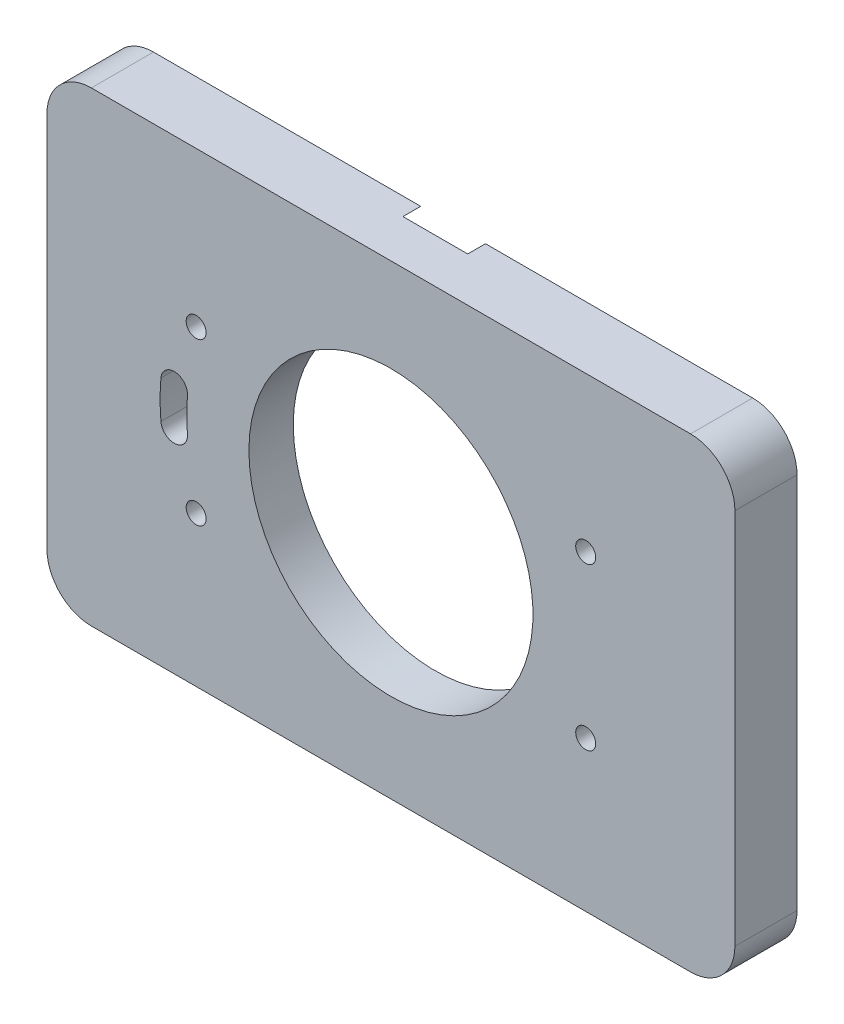
from build123d import *

# Parameters (mm, degrees)
SKETCH2_W           = 155
SKETCH2_H           = 105
BOSS_EXTRUDE1_DEPTH = 14
SKETCH3_R           = 53.5
CUT_EXTRUDE1_DEPTH  = 4
SKETCH4_R           = 32
CUT_EXTRUDE2_DEPTH  = 10
FILLET1_R           = 10
SKETCH5_R           = 2.25
CUT_EXTRUDE3_DEPTH  = 95.649352877
CUT_EXTRUDE4_DEPTH  = 95.649352877
SKETCH8_R           = 5
CUT_EXTRUDE6_DEPTH  = 2.5


with BuildPart() as part:
    # Sketch2 → Boss-Extrude1 (new body)
    with BuildSketch(Plane.XY):
        Rectangle(SKETCH2_W, SKETCH2_H)
    extrude(amount=BOSS_EXTRUDE1_DEPTH)

    # Sketch3 → Cut-Extrude1 (cut)
    with BuildSketch(Plane(origin=(0, 0, 0), x_dir=(-1, 0, 0), z_dir=(0, 0, -1))):
        with Locations((0, -0.5)):
            Circle(SKETCH3_R)
    extrude(amount=-CUT_EXTRUDE1_DEPTH, mode=Mode.SUBTRACT)

    # Sketch4 → Cut-Extrude2 (cut)
    with BuildSketch(Plane(origin=(0, 0, 4), x_dir=(-1, 0, 0), z_dir=(0, 0, -1))):
        with Locations((0, -0.5)):
            Circle(SKETCH4_R)
    extrude(amount=-CUT_EXTRUDE2_DEPTH, mode=Mode.SUBTRACT)

    # Fillet1
    fillet1_edges = [part.edges().sort_by_distance(p)[0] for p in [
        (77.5, -52.5, 7),
        (-77.5, -52.5, 7),
        (-77.5, 52.5, 7),
        (77.5, 52.5, 7),
    ]]
    fillet(fillet1_edges, radius=FILLET1_R)

    # Sketch5 → Cut-Extrude3 (cut, through all)
    with BuildSketch(Plane.XY.offset(14)):
        with Locations((43.884277794, 17.677463037)):
            Circle(SKETCH5_R)
        with Locations((43.884277794, -18.677463037)):
            Circle(SKETCH5_R)
        with Locations((-43.884277794, -18.677463037)):
            Circle(SKETCH5_R)
        with Locations((-43.884277794, 17.677463037)):
            Circle(SKETCH5_R)
    extrude(amount=-CUT_EXTRUDE3_DEPTH, mode=Mode.SUBTRACT)

    # Sketch6 → Cut-Extrude4 (cut, through all)
    with BuildSketch(Plane(origin=(0, 0, 0), x_dir=(-1, 0, 0), z_dir=(0, 0, -1))):
        with BuildLine():
            ThreePointArc((45.846474332, -4.255102041), (46, -0.5), (45.846474332, 3.255102041))
            ThreePointArc((45.846474332, 3.255102041), (48.591563829, 6.489987456), (51.826449245, 3.744897959))
            ThreePointArc((51.826449245, 3.744897959), (52, -0.5), (51.826449245, -4.744897959))
            ThreePointArc((51.826449245, -4.744897959), (48.591563829, -7.489987456), (45.846474332, -4.255102041))
        make_face()
    extrude(amount=-CUT_EXTRUDE4_DEPTH, mode=Mode.SUBTRACT)

    # Sketch8 → Cut-Extrude6 (cut)
    with BuildSketch(Plane(origin=(0, 0, 4), x_dir=(-1, 0, 0), z_dir=(0, 0, -1))):
        with Locations((43.884277794, 17.677463037)):
            Circle(SKETCH8_R)
        with Locations((43.884277794, -18.677463037)):
            Circle(SKETCH8_R)
        with Locations((-43.884277794, 17.677463037)):
            Circle(SKETCH8_R)
        with Locations((-43.884277794, -18.677463037)):
            Circle(SKETCH8_R)
    extrude(amount=-CUT_EXTRUDE6_DEPTH, mode=Mode.SUBTRACT)


solid = part.part
